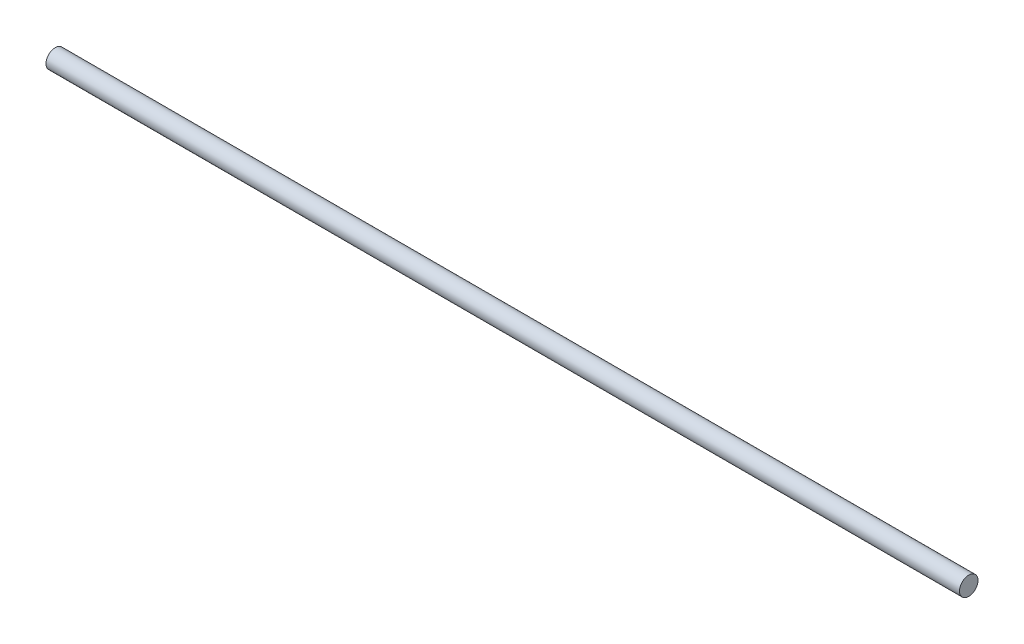
from build123d import *

# Parameters (mm, degrees)
SKETCH_1_R      = 4.05
EXTRUDE_1_DEPTH = 400


with BuildPart() as part:
    # Эскиз1 → Бобышка-Вытянуть1 (new body)
    with BuildSketch(Plane(origin=(0, 0, 0), x_dir=(0, 0, -1), z_dir=(1, 0, 0))):
        Circle(SKETCH_1_R)
    extrude(amount=EXTRUDE_1_DEPTH)


solid = part.part
